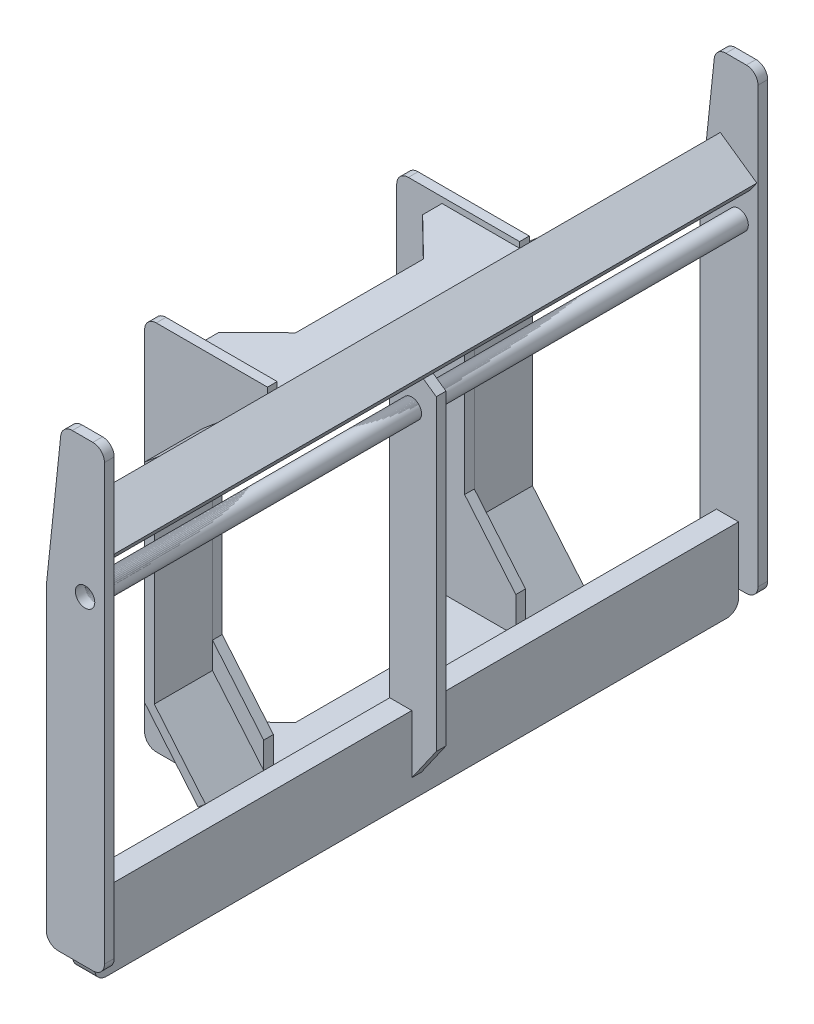
from build123d import *

# Parameters (mm, degrees)
BOSS_EXTRUDE1_START = 830
BOSS_EXTRUDE1_DEPTH = 25
BOSS_EXTRUDE2_START = -830
BOSS_EXTRUDE2_DEPTH = 25
SKETCH2_W           = 57
SKETCH2_H           = 150
SKETCH2_H_2         = 50
BOSS_EXTRUDE3_DEPTH = 1660
BOSS_EXTRUDE4_DEPTH = 12.5
SKETCH4_R           = 25
CUT_EXTRUDE1_DEPTH  = 2084.026644093
SKETCH5_R           = 25
SKETCH5_R_2         = 24.99
BOSS_EXTRUDE5_DEPTH = 1710
BOSS_EXTRUDE6_START = 300
BOSS_EXTRUDE6_DEPTH = 25
EXTRUDE_THIN2_DEPTH = 150
BOSS_EXTRUDE8_REACH = 1453.211
SKETCH8_W           = 150
SKETCH8_H           = 25
BOSS_EXTRUDE9_DEPTH = 25
LPATTERN1_COUNT     = 2
LPATTERN1_PITCH     = 870
FILLET1_R           = 30


with BuildPart() as part:
    # Sketch1 → Boss-Extrude1 (new body)
    with BuildSketch(Plane.XY.offset(BOSS_EXTRUDE1_START)):
        Polygon((0, 1180), (0, 0), (-150, 0), (-150, 800), (-110, 1180), align=None)
    extrude(amount=BOSS_EXTRUDE1_DEPTH)



with BuildPart() as body_2:
    # Sketch1<2> → Boss-Extrude2 (new body)
    with BuildSketch(Plane.XY.offset(BOSS_EXTRUDE2_START)):
        Polygon((0, 1180), (0, 0), (-150, 0), (-150, 800), (-110, 1180), align=None)
    extrude(amount=-BOSS_EXTRUDE2_DEPTH)


with BuildPart() as part_1:
    add(part.part)

    add(body_2.part)  # Boss-Extrude3 merges body 2
    # Sketch2 → Boss-Extrude3 (add)
    with BuildSketch(Plane.XY.offset(-830)):
        Polygon((-20.207293091, 905.425438671), (-114.409778184, 971.386728852), (-97.202485093, 995.96129018), (-3, 930), align=None)
        with Locations((-78.5, 75)):
            Rectangle(SKETCH2_W, SKETCH2_H)
        with Locations((-78.5, -25)):
            Rectangle(SKETCH2_W, SKETCH2_H_2)
    extrude(amount=BOSS_EXTRUDE3_DEPTH)

    # Sketch3 → Boss-Extrude4 (add, symmetric)
    with BuildSketch(Plane.XY):
        Polygon((-107, 150), (-107, 966.198346311), (-20.207293091, 905.425438671), (13, 882.173441726), (13, 89.973324425), (-50, 0), (-50, 150), align=None)
    extrude(amount=BOSS_EXTRUDE4_DEPTH, both=True)

    # Sketch4 → Cut-Extrude1 (cut, through all)
    with BuildSketch(Plane.XY.offset(855)):
        with Locations((-50, 825)):
            Circle(SKETCH4_R)
    extrude(amount=-CUT_EXTRUDE1_DEPTH, mode=Mode.SUBTRACT)

    # Sketch5 → Boss-Extrude5 (add)
    with BuildSketch(Plane.XY.offset(855)):
        with Locations((-50, 825)):
            Circle(SKETCH5_R)
        with Locations((-50, 825)):
            Circle(SKETCH5_R_2, mode=Mode.SUBTRACT)
    extrude(amount=-BOSS_EXTRUDE5_DEPTH)

    # Sketch6 → Boss-Extrude6 (add)
    with BuildSketch(Plane(origin=(0, 0, -12.5), x_dir=(-1, 0, 0), z_dir=(0, 0, -1)).offset(BOSS_EXTRUDE6_START)):
        Polygon((107, 217.929954778), (107, 150), (107, 52.96129018), (414, 52.96129018), (414, 1010.96129018), (97.202485093, 1010.96129018), (97.202485093, 995.96129018), (114.409778184, 971.386728852), (107, 966.198346311), (107, 902.667728725), (239, 783.814394878), (239, 375.241429), align=None)
    extrude(amount=BOSS_EXTRUDE6_DEPTH)


with BuildPart() as body_2_2:
    # Sketch7 → Extrude-Thin2 (new body)
    with BuildSketch(Plane(origin=(0, 0, -337.5), x_dir=(-1, 0, 0), z_dir=(0, 0, -1))):
        Polygon((107, 150), (239, 307.311474222), (239, 823.671886203), (107, 934.433037518), (123.069690242, 953.584148596), (264, 835.329577657), (264, 298.212218366), (126.151111078, 133.930309758), align=None)
    extrude(amount=EXTRUDE_THIN2_DEPTH)


with BuildPart() as body_3:
    # Boss-Extrude8: up to this plane
    boss_extrude8_end = Plane(origin=(418.76280579, 598.055266387, 1037.963939182), z_dir=(-0.5735764363510432, -0.8191520442889939, 0))
    # Sketch8 → Boss-Extrude8 (new, up to the surface)
    with BuildSketch(Plane(origin=(397.328272504, 333.398006914, 0), x_dir=(0, 0, -1), z_dir=(0.7660444431189801, 0.6427876096865369, 0)), mode=Mode.PRIVATE) as boss_extrude8_sk1:
        with Locations((412.5, 797.095510094)):
            Rectangle(SKETCH8_W, SKETCH8_H)
    boss_extrude8_tool1 = split(extrude(boss_extrude8_sk1.sketch, amount=BOSS_EXTRUDE8_REACH, mode=Mode.PRIVATE), bisect_by=boss_extrude8_end, keep=Keep.BOTH, mode=Mode.PRIVATE)
    add(boss_extrude8_tool1.solids().sort_by_distance((-115.034845, 944.008593, -412.5))[0])


with BuildPart() as body_4:
    # Mirror2: mirrored copy
    add(body_2_2.part.mirror(Plane.XY))


with BuildPart() as body_5:
    # Mirror2 2: mirrored copy
    add(part_1.part.mirror(Plane.XY))


with BuildPart() as part_2:
    add(part_1.part)

    add(body_5.part)  # Boss-Extrude9 merges body 5
    # Sketch9 → Boss-Extrude9 (add)
    with BuildSketch(Plane(origin=(0, 995.96129018, 0), x_dir=(1, 0, 0), z_dir=(0, 1, 0))):
        Polygon((-297.202485093, 312.5), (-97.202485093, 312.5), (-97.202485093, -312.5), (-297.202485093, -312.5), (-297.202485093, -262.5), (-197.202485093, -164.866379419), (-197.202485093, 164.866379419), (-297.202485093, 262.5), align=None)
    boss_extrude9 = extrude(amount=-BOSS_EXTRUDE9_DEPTH)

    # LPattern1: Boss-Extrude9 ×2
    with Locations(*[(0, -i * LPATTERN1_PITCH, 0) for i in range(1, LPATTERN1_COUNT)]):
        add(boss_extrude9)

    # Fillet1
    fillet1_edges = [part_2.edges().sort_by_distance(p)[0] for p in [
        (-414, 52.96129018, -325),
        (-414, 1010.96129018, -325),
        (-414, 52.96129018, 325),
        (-414, 1010.96129018, 325),
        (-110, 1180, -842.5),
        (0, 1180, -842.5),
        (0, 0, -842.5),
        (-150, 0, -842.5),
        (-78.5, -50, 830),
        (-78.5, -50, -830),
        (0, 1180, 842.5),
        (0, 0, 842.5),
        (-150, 0, 842.5),
        (-110, 1180, 842.5),
    ]]
    fillet(fillet1_edges, radius=FILLET1_R)


solid = Compound([body_2_2.part, body_3.part, body_4.part, part_2.part])
